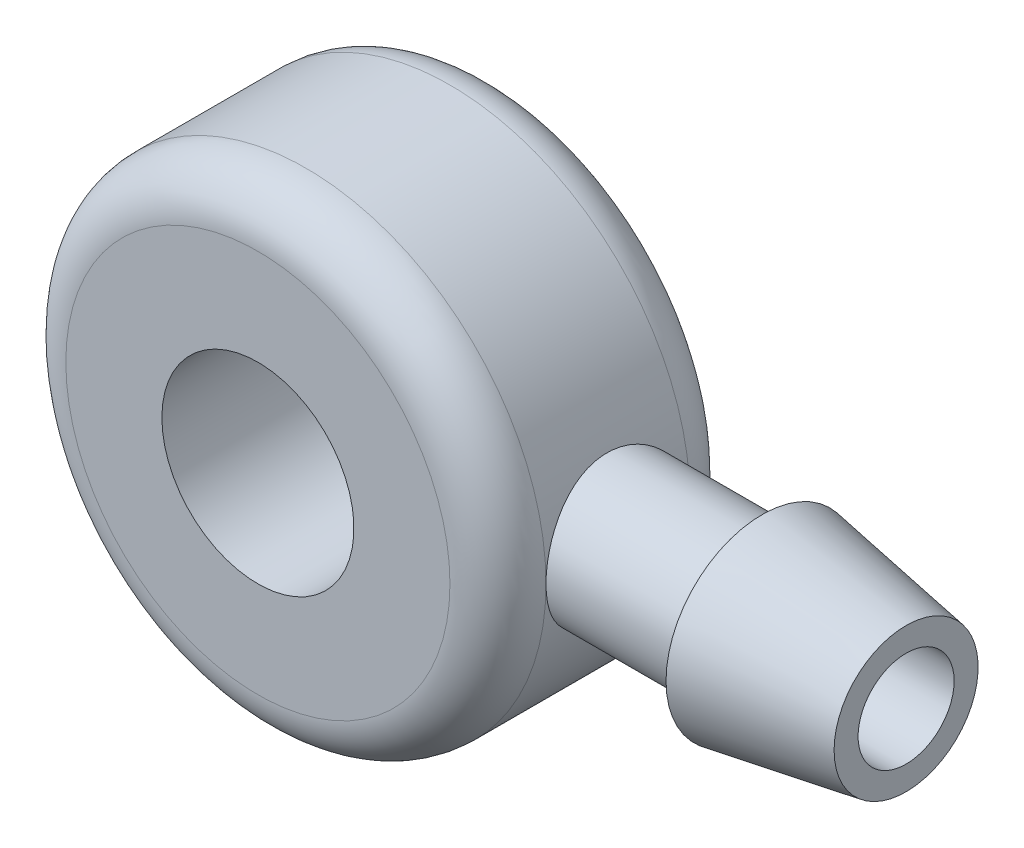
from build123d import *

# Parameters (mm, degrees)
SKETCH1_R           = 5
BOSS_EXTRUDE1_DEPTH = 5
FILLET1_R           = 1
SKETCH2_R           = 2
CUT_EXTRUDE1_DEPTH  = 5
SKETCH4_R           = 1
CUT_EXTRUDE2_DEPTH  = 10


with BuildPart() as part:
    # Sketch1 → Boss-Extrude1 (new body)
    with BuildSketch(Plane.XY):
        Circle(SKETCH1_R)
    extrude(amount=BOSS_EXTRUDE1_DEPTH)

    # Fillet1
    fillet1_edges = [part.edges().sort_by_distance(p)[0] for p in [
        (-5, 0, 0),
        (-5, 0, 5),
    ]]
    fillet(fillet1_edges, radius=FILLET1_R)

    # Sketch2 → Cut-Extrude1 (cut)
    with BuildSketch(Plane(origin=(0, 0, 0), x_dir=(-1, 0, 0), z_dir=(0, 0, -1))):
        Circle(SKETCH2_R)
    extrude(amount=-CUT_EXTRUDE1_DEPTH, mode=Mode.SUBTRACT)

    # Sketch3 → Revolve1 (revolve)
    with BuildSketch(Plane(origin=(0, 0, 0), x_dir=(1, 0, 0), z_dir=(0, 1, 0)), mode=Mode.PRIVATE) as revolve1_sk:
        Polygon((4.094510591, -1), (8, -1), (8, -0.5), (11, -1), (11, -2.5), (4.094510591, -2.5), align=None)
    revolve(revolve1_sk.sketch.rotate(Axis((5, 0, 2.5), (1, 0, 0)), 180), axis=Axis((5, 0, 2.5), (1, 0, 0)))

    # Sketch4 → Cut-Extrude2 (cut)
    with BuildSketch(Plane(origin=(11, 0, 0), x_dir=(0, 0, -1), z_dir=(1, 0, 0))):
        with Locations((-2.5, 0)):
            Circle(SKETCH4_R)
    extrude(amount=-CUT_EXTRUDE2_DEPTH, mode=Mode.SUBTRACT)


solid = part.part
